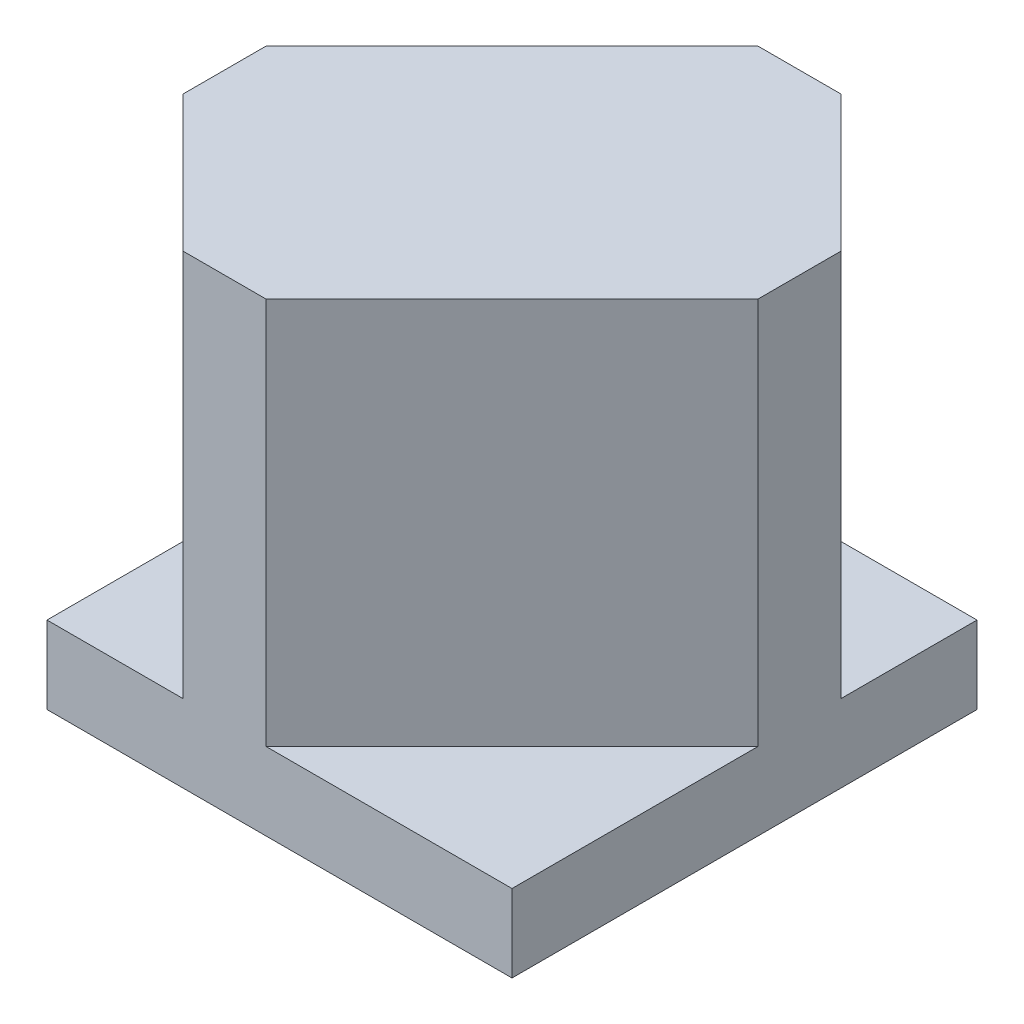
from build123d import *

# Parameters (mm, degrees)
BOSS_EXTRUDE1_DEPTH = 60
BOSS_EXTRUDE2_DEPTH = 10


with BuildPart() as part:
    # Sketch1 → Boss-Extrude1 (new body)
    with BuildSketch(Plane(origin=(0, 0, 0), x_dir=(1, 0, 0), z_dir=(0, 1, 0))):
        Polygon((-30, -12.426406871), (-12.426406871, -30), (-1.715728753, -30), (30, 1.715728753), (30, 12.426406871), (12.426406871, 30), (1.715728753, 30), (-30, -1.715728753), align=None)
    extrude(amount=BOSS_EXTRUDE1_DEPTH)

    # Sketch1<3> → Boss-Extrude2 (add)
    with BuildSketch(Plane(origin=(0, 0, 0), x_dir=(1, 0, 0), z_dir=(0, 1, 0))):
        Polygon((-30, -12.426406871), (-30, -30), (-12.426406871, -30), align=None)
        Polygon((30, 1.715728753), (-1.715728753, -30), (30, -30), align=None)
        Polygon((-30, 30), (-30, -1.715728753), (1.715728753, 30), align=None)
        Polygon((12.426406871, 30), (30, 12.426406871), (30, 30), align=None)
    extrude(amount=BOSS_EXTRUDE2_DEPTH)


solid = part.part
